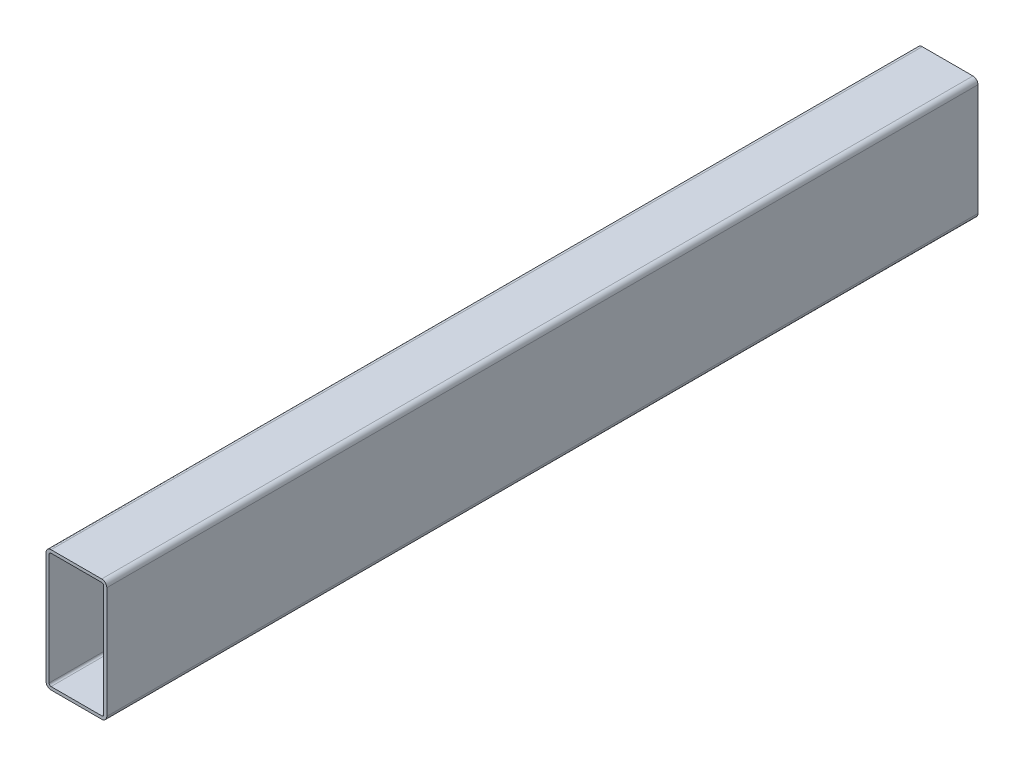
from build123d import *

# Parameters (mm, degrees)
EXTRUDE_THIN1_DEPTH      = 430
EXTRUDE_THIN1_DEPTH_BACK = 430


with BuildPart() as part:
    # Sketch1 → Extrude-Thin1 (new, two sides: drawn at the far end of the back side and taken through both)
    with BuildSketch(Plane.XY.offset(-EXTRUDE_THIN1_DEPTH_BACK)):
        with BuildLine():
            Line((25, 60), (-25, 60))
            ThreePointArc((-25, 60), (-28.535533906, 58.535533906), (-30, 55))
            Line((-30, 55), (-30, -55))
            ThreePointArc((-30, -55), (-28.535533906, -58.535533906), (-25, -60))
            Line((-25, -60), (25, -60))
            ThreePointArc((25, -60), (28.535533906, -58.535533906), (30, -55))
            Line((30, -55), (30, 55))
            ThreePointArc((30, 55), (28.535533906, 58.535533906), (25, 60))
        make_face()
        with BuildLine():
            Line((25, 57), (-25, 57))
            ThreePointArc((-25, 57), (-26.414213562, 56.414213562), (-27, 55))
            Line((-27, 55), (-27, -55))
            ThreePointArc((-27, -55), (-26.414213562, -56.414213562), (-25, -57))
            Line((-25, -57), (25, -57))
            ThreePointArc((25, -57), (26.414213562, -56.414213562), (27, -55))
            Line((27, -55), (27, 55))
            ThreePointArc((27, 55), (26.414213562, 56.414213562), (25, 57))
        make_face(mode=Mode.SUBTRACT)
    extrude(amount=EXTRUDE_THIN1_DEPTH + EXTRUDE_THIN1_DEPTH_BACK)


solid = part.part
